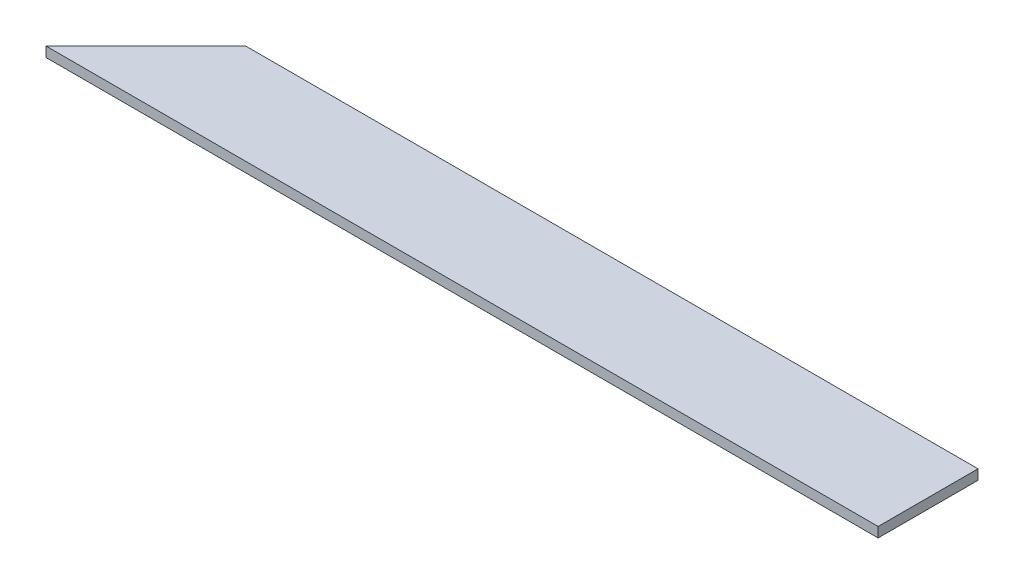
from build123d import *

# Parameters (mm, degrees)
BOSS_EXTRUDE2_DEPTH = 3


with BuildPart() as part:
    # Sketch1 → Boss-Extrude2 (new body)
    with BuildSketch(Plane(origin=(0, 0, 0), x_dir=(1, 0, 0), z_dir=(0, 1, 0))):
        Polygon((-125, -15), (-95, 15), (125, 15), (125, -15), align=None)
    extrude(amount=BOSS_EXTRUDE2_DEPTH)


solid = part.part
